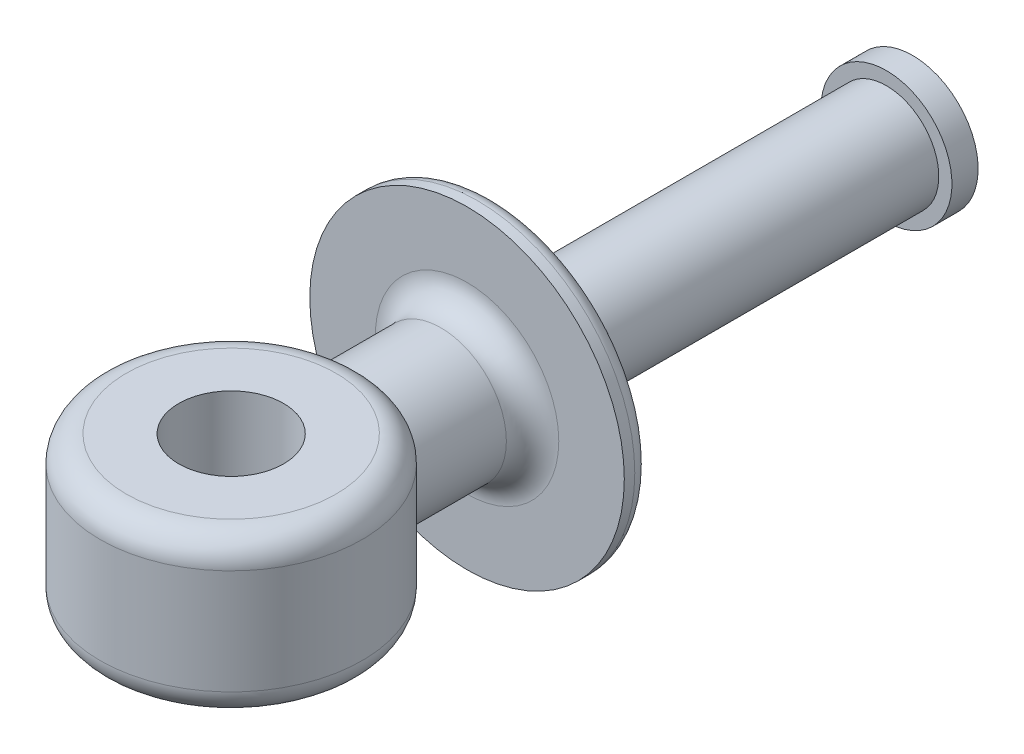
from build123d import *

# Parameters (mm, degrees)
SKETCH_1_R          = 10
EXTRUDE_1_DEPTH     = 75
SKETCH_2_R          = 12.5
EXTRUDE_2_DEPTH     = 5
SKETCH_3_R          = 30
EXTRUDE_3_DEPTH     = 5
EXTRUDE_START       = 30
SKETCH_4_R          = 12.5
EXTRUDE_4_DEPTH     = 30
SKETCH_5_R          = 25
EXTRUDE_5_DEPTH     = 15
SKETCH_6_R          = 10
CUT_EXTRUDE_1_DEPTH = 160.452187191
FILLET_1_R          = 5
FILLET_2_R          = 5
FILLET_4_R          = 3
SCALE_1_SCALE       = 0.5


with BuildPart() as part:
    # 草图1 → 凸台-拉伸1 (new body)
    with BuildSketch(Plane.XY):
        Circle(SKETCH_1_R)
    extrude(amount=EXTRUDE_1_DEPTH)

    # 草图2 → 凸台-拉伸2 (add)
    with BuildSketch(Plane(origin=(0, 0, 0), x_dir=(-1, 0, 0), z_dir=(0, 0, -1))):
        Circle(SKETCH_2_R)
    extrude(amount=EXTRUDE_2_DEPTH)

    # 草图3 → 凸台-拉伸3 (add)
    with BuildSketch(Plane.XY.offset(75)):
        Circle(SKETCH_3_R)
    extrude(amount=EXTRUDE_3_DEPTH)

    # 草图4 → 凸台-拉伸4 (add)
    with BuildSketch(Plane.XY.offset(80).offset(EXTRUDE_START)):
        with Locations(Location((0, 0, 0), (0, 0, 180))):
            Circle(SKETCH_4_R)
    extrude(amount=-EXTRUDE_4_DEPTH)

    # 圆角1
    fillet_1_edges = [part.edges().sort_by_distance(p)[0] for p in [
        (12.5, 0, 80),
    ]]
    fillet(fillet_1_edges, radius=FILLET_1_R)

    # 圆角4
    fillet_4_edges = [part.edges().sort_by_distance(p)[0] for p in [
        (-30, 0, 75),
    ]]
    fillet(fillet_4_edges, radius=FILLET_4_R)


with BuildPart() as body_2:
    # 草图5 → 凸台-拉伸5 (new, symmetric)
    with BuildSketch(Plane(origin=(0, 0, 0), x_dir=(1, 0, 0), z_dir=(0, 1, 0))):
        with Locations(Location((0, -125, 0), (0, 0, 270))):
            Circle(SKETCH_5_R)
    extrude(amount=EXTRUDE_5_DEPTH, both=True)

    # 草图6 → 切除-拉伸1 (cut, through all)
    with BuildSketch(Plane(origin=(0, 15, 0), x_dir=(1, 0, 0), z_dir=(0, 1, 0))):
        with Locations(Location((0, -125, 0), (0, 0, 270))):
            Circle(SKETCH_6_R)
    extrude(amount=-CUT_EXTRUDE_1_DEPTH, mode=Mode.SUBTRACT)

    # 圆角2
    fillet_2_edges = [body_2.edges().sort_by_distance(p)[0] for p in [
        (0, -15, 100),
        (0, 15, 100),
    ]]
    fillet(fillet_2_edges, radius=FILLET_2_R)


with BuildPart() as body_2_1:
    # 缩放比例1: scaled about (0, 0, 0)
    add(body_2.part.scale(SCALE_1_SCALE))


with BuildPart() as part_1:
    # 缩放比例1: scaled about (0, 0, 0)
    add(part.part.scale(SCALE_1_SCALE))


solid = Compound([body_2_1.part, part_1.part])
